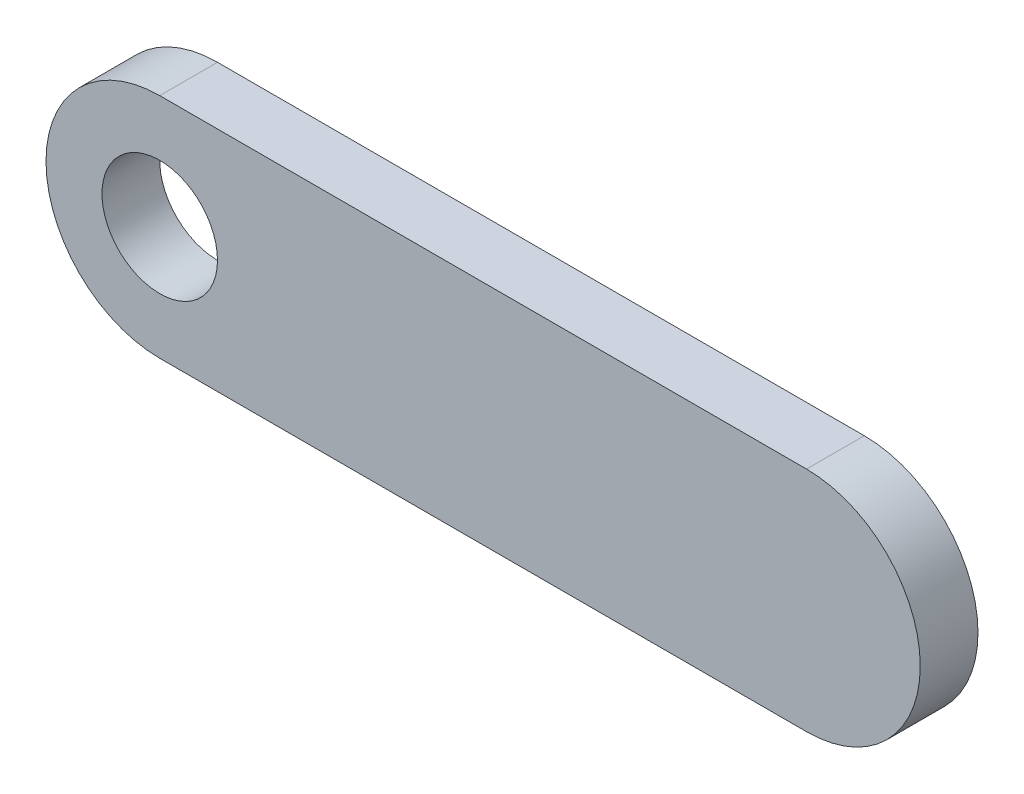
from build123d import *

# Parameters (mm, degrees)
SKETCH2_R           = 25
BOSS_EXTRUDE2_DEPTH = 25


with BuildPart() as part:
    # Sketch2 → Boss-Extrude2 (new body)
    with BuildSketch(Plane.XY):
        with BuildLine():
            Line((0, 49.234682879), (280, 49.234682879))
            ThreePointArc((280, 49.234682879), (329.234682879, 0), (280, -49.234682879))
            Line((280, -49.234682879), (0, -49.234682879))
            ThreePointArc((0, -49.234682879), (-49.234682879, 0), (0, 49.234682879))
        make_face()
        Circle(SKETCH2_R, mode=Mode.SUBTRACT)
    extrude(amount=BOSS_EXTRUDE2_DEPTH)


solid = part.part
